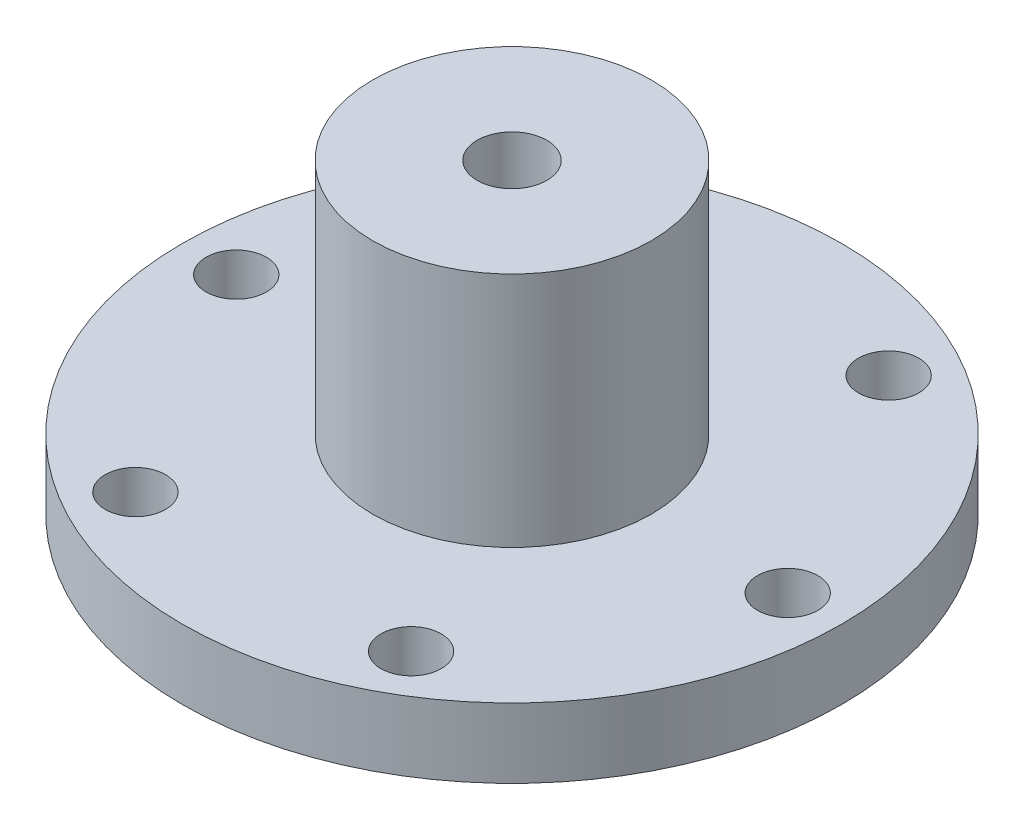
from build123d import *

# Parameters (mm, degrees)
SKETCH1_R           = 28.399999969
BOSS_EXTRUDE1_DEPTH = 6
SKETCH2_R           = 12
BOSS_EXTRUDE2_DEPTH = 20.4
SKETCH3_R           = 3
CUT_EXTRUDE1_DEPTH  = 49.063291569
SKETCH4_R           = 2.6
CUT_EXTRUDE2_DEPTH  = 46.047530415
SKETCH6_R           = 1.65
CUT_EXTRUDE3_DEPTH  = 49.063291569


with BuildPart() as part:
    # Sketch1 → Boss-Extrude1 (new body)
    with BuildSketch(Plane(origin=(0, 0, 0), x_dir=(1, 0, 0), z_dir=(0, 1, 0))):
        with Locations(Location((0, 0, 0), (0, 0, 270))):
            Circle(SKETCH1_R)
    extrude(amount=BOSS_EXTRUDE1_DEPTH)

    # Sketch2 → Boss-Extrude2 (add)
    with BuildSketch(Plane(origin=(0, 6, 0), x_dir=(1, 0, 0), z_dir=(0, 1, 0))):
        with Locations(Location((0, 0, 0), (0, 0, 270))):
            Circle(SKETCH2_R)
    extrude(amount=BOSS_EXTRUDE2_DEPTH)

    # Sketch3 → Cut-Extrude1 (cut, through all)
    with BuildSketch(Plane(origin=(0, 26.4, 0), x_dir=(1, 0, 0), z_dir=(0, 1, 0))):
        with Locations(Location((0, 0, 0), (0, 0, 270))):
            Circle(SKETCH3_R)
    extrude(amount=-CUT_EXTRUDE1_DEPTH, mode=Mode.SUBTRACT)

    # Sketch4 → Cut-Extrude2 (cut, through all)
    with BuildSketch(Plane(origin=(0, 6, 0), x_dir=(1, 0, 0), z_dir=(0, 1, 0))):
        with Locations(Location((23.75, 0, 0), (0, 0, 270))):
            Circle(SKETCH4_R)
        with Locations(Location((11.875, -20.56810334, 0), (0, 0, 270))):
            Circle(SKETCH4_R)
        with Locations(Location((-11.875, -20.56810334, 0), (0, 0, 270))):
            Circle(SKETCH4_R)
        with Locations(Location((-23.75, 0, 0), (0, 0, 270))):
            Circle(SKETCH4_R)
        with Locations(Location((-11.875, 20.56810334, 0), (0, 0, 270))):
            Circle(SKETCH4_R)
        with Locations(Location((11.875, 20.56810334, 0), (0, 0, 270))):
            Circle(SKETCH4_R)
    extrude(amount=-CUT_EXTRUDE2_DEPTH, mode=Mode.SUBTRACT)

    # Sketch6 → Cut-Extrude3 (cut, through all)
    with BuildSketch(Plane(origin=(0, 0, 0), x_dir=(0, 0, -1), z_dir=(1, 0, 0))):
        with Locations((0, 16.2)):
            Circle(SKETCH6_R)
    extrude(amount=-CUT_EXTRUDE3_DEPTH, mode=Mode.SUBTRACT)


solid = part.part
